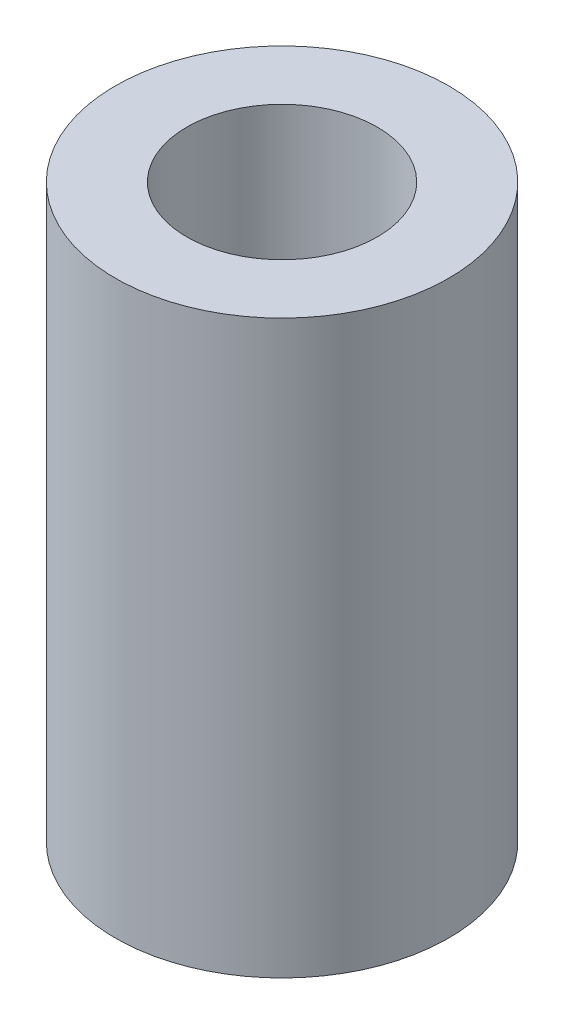
from build123d import *

# Parameters (mm, degrees)
SKETCH1_R           = 22.225
SKETCH1_R_2         = 12.7
BOSS_EXTRUDE1_DEPTH = 76.2


with BuildPart() as part:
    # Sketch1 → Boss-Extrude1 (new body)
    with BuildSketch(Plane(origin=(0, 0, 0), x_dir=(1, 0, 0), z_dir=(0, 1, 0))):
        with Locations(Location((0, 0, 0), (0, 0, 90))):
            Circle(SKETCH1_R)
        with Locations(Location((0, 0, 0), (0, 0, 90))):
            Circle(SKETCH1_R_2, mode=Mode.SUBTRACT)
    extrude(amount=BOSS_EXTRUDE1_DEPTH)


solid = part.part
